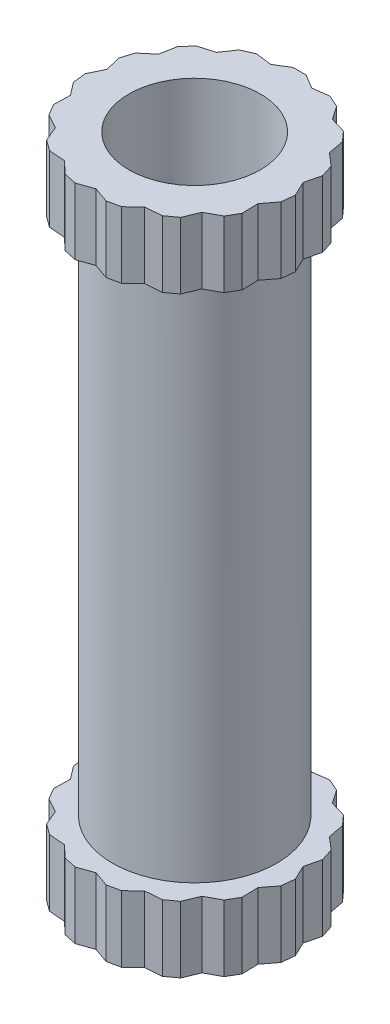
from build123d import *

# Parameters (mm, degrees)
SKETCH1_R           = 1.25
SKETCH1_R_2         = 1
BOSS_EXTRUDE1_DEPTH = 4
SKETCH2_R           = 1
BOSS_EXTRUDE2_DEPTH = 1.01


with BuildPart() as part:
    # Sketch1 → Boss-Extrude1 (new body)
    with BuildSketch(Plane(origin=(0, 0, 0), x_dir=(1, 0, 0), z_dir=(0, 1, 0))):
        with Locations(Location((0, 0, 0), (0, 0, 270))):
            Circle(SKETCH1_R)
        with Locations(Location((0, 0, 0), (0, 0, 270))):
            Circle(SKETCH1_R_2, mode=Mode.SUBTRACT)
    boss_extrude1 = extrude(amount=BOSS_EXTRUDE1_DEPTH)

    # Sketch2 → Boss-Extrude2 (add)
    with BuildSketch(Plane(origin=(0, 4, 0), x_dir=(1, 0, 0), z_dir=(0, 1, 0))):
        Polygon((-0.740860879, 1.418141445), (-0.881677878, 1.213525492), (-1.11979406, 1.142830374), (-1.253620181, 0.994201408), (-1.299038106, 0.75), (-1.487813767, 0.58856622), (-1.549617166, 0.398354916), (-1.491782843, 0.156792695), (-1.598576957, -0.067466381), (-1.577671264, -0.26637076), (-1.426584774, -0.463525492), (-1.432931669, -0.711833431), (-1.332931669, -0.885038512), (-1.114717238, -1.00369591), (-1.019519477, -1.233118014), (-0.857716078, -1.350675064), (-0.610104965, -1.370318186), (-0.429823106, -1.54118529), (-0.234193585, -1.582767628), (0, -1.5), (0.234193585, -1.582767628), (0.429823106, -1.54118529), (0.610104965, -1.370318186), (0.857716078, -1.350675064), (1.019519477, -1.233118014), (1.114717238, -1.00369591), (1.332931669, -0.885038512), (1.432931669, -0.711833431), (1.426584774, -0.463525492), (1.577671264, -0.26637076), (1.598576957, -0.067466381), (1.491782843, 0.156792695), (1.549617166, 0.398354916), (1.487813767, 0.58856622), (1.299038106, 0.75), (1.253620181, 0.994201408), (1.11979406, 1.142830374), (0.881677878, 1.213525492), (0.740860879, 1.418141445), (0.558151787, 1.499488774), (0.311867536, 1.467221401), (0.1, 1.596871942), (-0.1, 1.596871942), (-0.311867536, 1.467221401), (-0.558151787, 1.499488774), align=None)
        with Locations(Location((0, 0, 0), (0, 0, 270))):
            Circle(SKETCH2_R, mode=Mode.SUBTRACT)
    boss_extrude2 = extrude(amount=BOSS_EXTRUDE2_DEPTH)

    # Mirror1: Boss-Extrude1, Boss-Extrude2 across plane
    add(boss_extrude1.mirror(Plane.ZX))
    add(boss_extrude2.mirror(Plane.ZX))


solid = part.part
